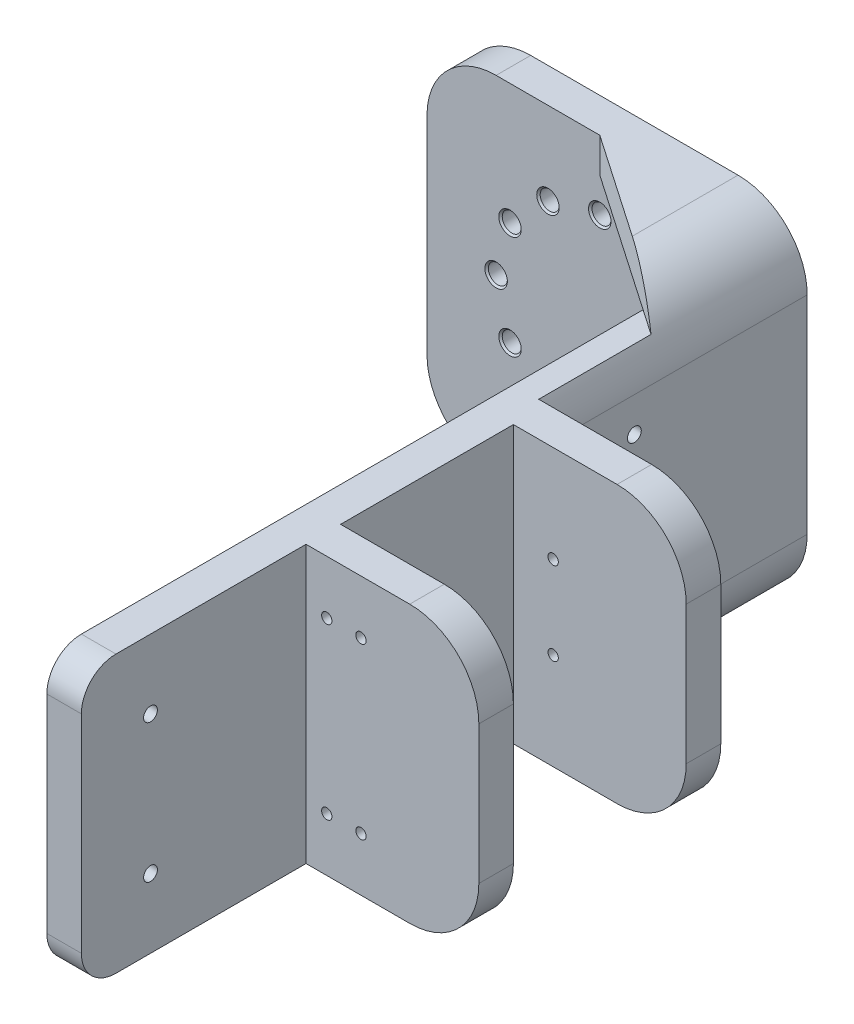
from build123d import *

# Parameters (mm, degrees)
SKETCH_1_W           = 200
SKETCH_1_H           = 80
EXTRUDE_1_DEPTH      = 10
SKETCH_2_W           = 10
SKETCH_2_H           = 80
EXTRUDE_2_DEPTH      = 50
SKETCH_3_W           = 100
SKETCH_3_H           = 100
EXTRUDE_3_DEPTH      = 10
EXTRUDE_4_DEPTH      = 15
EXTRUDE_5_DEPTH      = 15
FILLET_1_R           = 20
SKETCH_7_R           = 2.75
CUT_EXTRUDE_1_DEPTH  = 15
CUT_EXTRUDE_START    = -60
SKETCH_8_R           = 1.5
CUT_EXTRUDE_2_DEPTH  = 15
SKETCH_9_R           = 1.5
CUT_EXTRUDE_3_DEPTH  = 15
FILLET_2_R           = 20
SKETCH_16_R          = 2.75
CUT_EXTRUDE_7_DEPTH  = 225.944437584
CHAMFER_2_SIZE       = 0.5
CHAMFER_3_SIZE       = 0.5
EXTRUDE_8_DEPTH      = 10
CUT_EXTRUDE_8_DEPTH  = 225.944437584
CUT_EXTRUDE_9_DEPTH  = 225.944437584
SKETCH_20_R          = 2
CUT_EXTRUDE_10_DEPTH = 151.665191733
FILLET_3_R           = 10


with BuildPart() as part:
    # 草图1 → 凸台-拉伸1 (new body)
    with BuildSketch(Plane(origin=(0, 0, 0), x_dir=(0, 0, -1), z_dir=(1, 0, 0))):
        Rectangle(SKETCH_1_W, SKETCH_1_H)
    extrude(amount=EXTRUDE_1_DEPTH)

    # 草图2 → 凸台-拉伸2 (add)
    with BuildSketch(Plane(origin=(10, 0, 0), x_dir=(0, 0, -1), z_dir=(1, 0, 0))):
        with Locations((-30, 0)):
            Rectangle(SKETCH_2_W, SKETCH_2_H)
        with Locations((30, 0)):
            Rectangle(SKETCH_2_W, SKETCH_2_H)
    extrude(amount=EXTRUDE_2_DEPTH)

    # 草图3 → 凸台-拉伸3 (add)
    with BuildSketch(Plane(origin=(0, 0, -100), x_dir=(-1, 0, 0), z_dir=(0, 0, -1))):
        with Locations((40, 0)):
            Rectangle(SKETCH_3_W, SKETCH_3_H)
    extrude(amount=EXTRUDE_3_DEPTH)

    # 草图5 → 凸台-拉伸4 (add)
    with BuildSketch(Plane(origin=(0, 40, 0), x_dir=(1, 0, 0), z_dir=(0, 1, 0))):
        Polygon((10, 55), (-15, 100), (10, 100), align=None)
    extrude(amount=-EXTRUDE_4_DEPTH)

    # 草图6 → 凸台-拉伸5 (add)
    with BuildSketch(Plane.XZ.offset(40)):
        Polygon((-15, -100), (0, -100), (0, -73), align=None)
    extrude(amount=-EXTRUDE_5_DEPTH)

    # 圆角1
    fillet_1_edges = [part.edges().sort_by_distance(p)[0] for p in [
        (10, 50, -105),
        (10, -50, -105),
        (-90, 50, -105),
        (-90, -50, -105),
    ]]
    fillet(fillet_1_edges, radius=FILLET_1_R)

    # 草图7 → 切除-拉伸1 (cut)
    with BuildSketch(Plane(origin=(0, 0, -110), x_dir=(-1, 0, 0), z_dir=(0, 0, -1))):
        with Locations(Location((40, 30, 0), (0, 0, 90))):
            Circle(SKETCH_7_R)
        with Locations(Location((10, 0, 0), (0, 0, 90))):
            Circle(SKETCH_7_R)
        with Locations(Location((70, 0, 0), (0, 0, 90))):
            Circle(SKETCH_7_R)
        with Locations(Location((40, -30, 0), (0, 0, 90))):
            Circle(SKETCH_7_R)
    extrude(amount=-CUT_EXTRUDE_1_DEPTH, mode=Mode.SUBTRACT)

    # 草图8 → 切除-拉伸2 (cut)
    with BuildSketch(Plane(origin=(0, 0, -35), x_dir=(-1, 0, 0), z_dir=(0, 0, -1)).offset(CUT_EXTRUDE_START)):
        with Locations(Location((-16, 24.5, 0), (0, 0, 90))):
            Circle(SKETCH_8_R)
        with Locations(Location((-25.9, 24.5, 0), (0, 0, 90))):
            Circle(SKETCH_8_R)
        with Locations(Location((-16, -24.5, 0), (0, 0, 90))):
            Circle(SKETCH_8_R)
        with Locations(Location((-25.9, -24.5, 0), (0, 0, 90))):
            Circle(SKETCH_8_R)
    extrude(amount=-CUT_EXTRUDE_2_DEPTH, mode=Mode.SUBTRACT)

    # 草图9 → 切除-拉伸3 (cut)
    with BuildSketch(Plane.XY.offset(35).offset(CUT_EXTRUDE_START)):
        with Locations((21.5, 12)):
            Circle(SKETCH_9_R)
        with Locations((21.5, -12)):
            Circle(SKETCH_9_R)
    extrude(amount=-CUT_EXTRUDE_3_DEPTH, mode=Mode.SUBTRACT)

    # 圆角2
    fillet_2_edges = [part.edges().sort_by_distance(p)[0] for p in [
        (60, -40, 30),
        (60, 40, 30),
        (60, -40, -30),
        (60, 40, -30),
    ]]
    fillet(fillet_2_edges, radius=FILLET_2_R)

    # 草图16 → 切除-拉伸7 (cut, through all)
    with BuildSketch(Plane.XY.offset(-100)):
        with Locations((-25, 25.980762114)):
            Circle(SKETCH_16_R)
        with Locations((-14.019237886, 15)):
            Circle(SKETCH_16_R)
        with Locations(Location((-25, -25.980762114, 0), (0, 0, 180))):
            Circle(SKETCH_16_R)
        with Locations(Location((-14.019237886, -15, 0), (0, 0, 180))):
            Circle(SKETCH_16_R)
        with Locations(Location((-55, 25.980762114, 0), (0, 0, 180))):
            Circle(SKETCH_16_R)
        with Locations(Location((-65.980762114, 15, 0), (0, 0, 180))):
            Circle(SKETCH_16_R)
        with Locations((-55, -25.980762114)):
            Circle(SKETCH_16_R)
        with Locations((-65.980762114, -15)):
            Circle(SKETCH_16_R)
    extrude(amount=-CUT_EXTRUDE_7_DEPTH, mode=Mode.SUBTRACT)

    # 倒角2
    chamfer_2_edges = [part.edges().sort_by_distance(p)[0] for p in [
        (-70, -2.75, -100),
        (-70, -2.75, -110),
        (-40, -32.75, -100),
        (-40, -32.75, -110),
        (-52.25, 25.980762114, -110),
        (-52.25, 25.980762114, -100),
        (-68.730762114, -15, -110),
        (-68.730762114, -15, -100),
        (-57.75, -25.980762114, -110),
        (-57.75, -25.980762114, -100),
        (-63.230762114, 15, -110),
        (-63.230762114, 15, -100),
    ]]
    chamfer(chamfer_2_edges, length=CHAMFER_2_SIZE)

    # 倒角3
    chamfer_3_edges = [part.edges().sort_by_distance(p)[0] for p in [
        (-40, 27.25, -100),
        (-40, 27.25, -110),
        (-10, -2.75, -100),
        (-10, -2.75, -110),
        (-11.269237886, -15, -110),
        (-11.269237886, -15, -100),
        (-22.25, -25.980762114, -110),
        (-22.25, -25.980762114, -100),
        (-16.769237886, 15, -110),
        (-16.769237886, 15, -100),
        (-27.75, 25.980762114, -110),
        (-27.75, 25.980762114, -100),
    ]]
    chamfer(chamfer_3_edges, length=CHAMFER_3_SIZE)

    # 草图17 → 凸台-拉伸8 (add)
    with BuildSketch(Plane.XZ.offset(40)):
        Polygon((7.320508076, -100), (-40, -100), (7.320508076, -67.5), align=None)
    extrude_8 = extrude(amount=EXTRUDE_8_DEPTH)

    # 草图18 → 切除-拉伸8 (cut, through all)
    with BuildSketch(Plane(origin=(0, 0, -100), x_dir=(-1, 0, 0), z_dir=(0, 0, -1))):
        with BuildLine():
            Line((-7.320508076, -40), (-7.320508076, -50))
            Line((-7.320508076, -50), (10, -50))
            ThreePointArc((10, -50), (0, -47.320508076), (-7.320508076, -40))
        make_face()
    extrude(amount=-CUT_EXTRUDE_8_DEPTH, mode=Mode.SUBTRACT)

    # 镜向2: 凸台-拉伸8 across plane
    add(extrude_8.mirror(Plane.ZX))

    # 草图19 → 切除-拉伸9 (cut, through all)
    with BuildSketch(Plane(origin=(0, 0, -100), x_dir=(-1, 0, 0), z_dir=(0, 0, -1))):
        with BuildLine():
            Line((-7.320508076, 50), (-7.320508076, 40))
            ThreePointArc((-7.320508076, 40), (0, 47.320508076), (10, 50))
            Line((10, 50), (-7.320508076, 50))
        make_face()
    extrude(amount=-CUT_EXTRUDE_9_DEPTH, mode=Mode.SUBTRACT)

    # 草图20 → 切除-拉伸10 (cut, through all)
    with BuildSketch(Plane.ZY):
        with Locations((80, 20)):
            Circle(SKETCH_20_R)
        with Locations((80, -20)):
            Circle(SKETCH_20_R)
        with Locations((-60, 20)):
            Circle(SKETCH_20_R)
        with Locations((-60, -20)):
            Circle(SKETCH_20_R)
    extrude(amount=-CUT_EXTRUDE_10_DEPTH, mode=Mode.SUBTRACT)

    # 圆角3
    fillet_3_edges = [part.edges().sort_by_distance(p)[0] for p in [
        (5, 40, 100),
        (5, -40, 100),
    ]]
    fillet(fillet_3_edges, radius=FILLET_3_R)


solid = part.part
